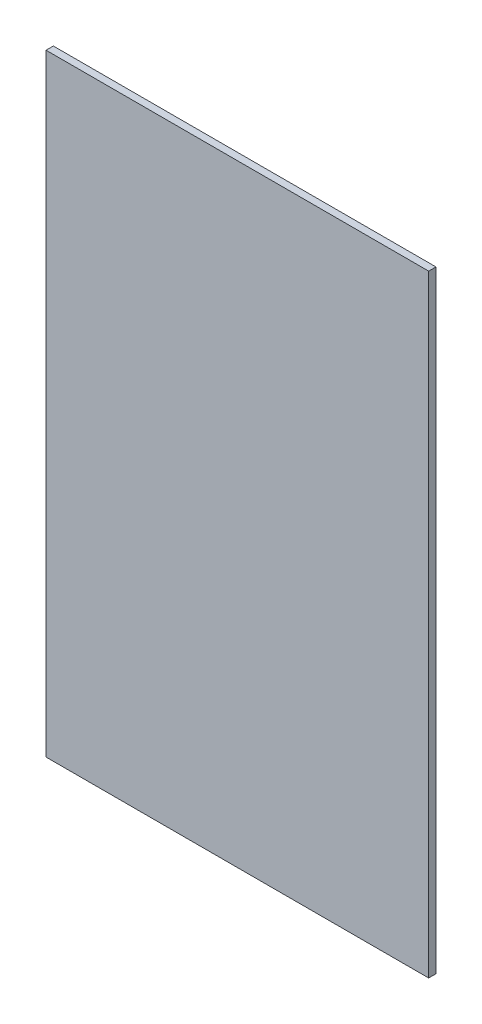
from build123d import *

# Parameters (mm, degrees)
SKETCH1_W           = 420
SKETCH1_H           = 672
BOSS_EXTRUDE1_DEPTH = 8


with BuildPart() as part:
    # Sketch1 → Boss-Extrude1 (new body)
    with BuildSketch(Plane.XY):
        with Locations((210, 336)):
            Rectangle(SKETCH1_W, SKETCH1_H)
    extrude(amount=BOSS_EXTRUDE1_DEPTH)


solid = part.part
